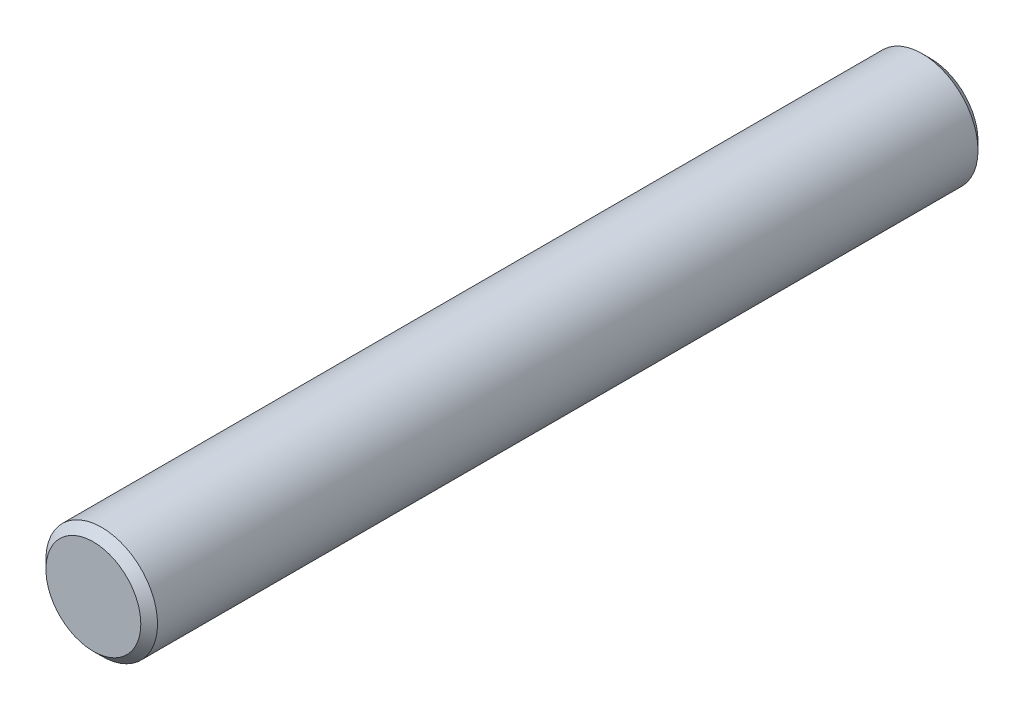
from build123d import *

# Parameters (mm, degrees)
BOSS_EXTRUDE1_DEPTH      = 30
BOSS_EXTRUDE1_DEPTH_BACK = 30
SKETCH3_R                = 4
CHAMFER1_SIZE            = 0.6


with BuildPart() as part:
    # Sketch3 → Boss-Extrude1 (new, two sides: drawn at the far end of the back side and taken through both)
    with BuildSketch(Plane.XY.offset(-BOSS_EXTRUDE1_DEPTH_BACK)):
        Circle(SKETCH3_R)
    extrude(amount=BOSS_EXTRUDE1_DEPTH + BOSS_EXTRUDE1_DEPTH_BACK)

    # Chamfer1
    chamfer1_edges = [part.edges().sort_by_distance(p)[0] for p in [
        (-4, 0, -30),
        (-4, 0, 30),
    ]]
    chamfer(chamfer1_edges, length=CHAMFER1_SIZE)


solid = part.part
